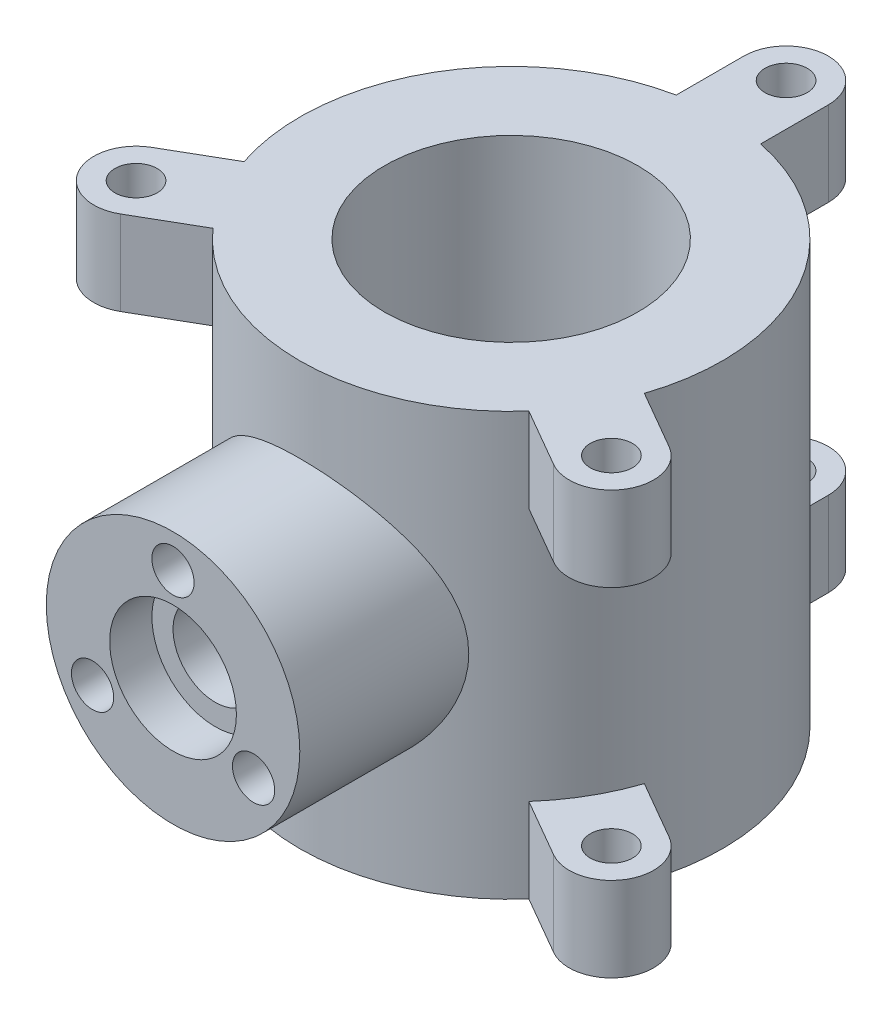
from build123d import *

# Parameters (mm, degrees)
SKETCH1_R           = 30
BOSS_EXTRUDE3_DEPTH = 100
SKETCH1_6_R         = 5
BOSS_EXTRUDE4_DEPTH = 20
BOSS_EXTRUDE6_REACH = 198.02
SKETCH2_R           = 30
SKETCH2_R_2         = 10
SKETCH2_5_R         = 15
SKETCH2_5_R_2       = 10
CUT_EXTRUDE1_DEPTH  = 10
SKETCH2_6_R         = 5
CUT_EXTRUDE2_DEPTH  = 10
CUT_EXTRUDE3_REACH  = 198.02
SKETCH2_7_R         = 10


with BuildPart() as part:
    # Sketch1 → Boss-Extrude3 (new body)
    with BuildSketch(Plane(origin=(0, 0, 0), x_dir=(1, 0, 0), z_dir=(0, 1, 0))):
        with BuildLine():
            ThreePointArc((-37.464834222, -33.11172295), (-0.057995625, -49.999966365), (37.387920062, -33.198545653))
            ThreePointArc((37.387920062, -33.198545653), (43.272243248, -25.050208867), (47.408010349, -15.88963671))
            ThreePointArc((47.408010349, -15.88963671), (49.347748264, -8.049828649), (50, 0))
            ThreePointArc((50, 0), (38.748168948, 31.600307011), (10.056823873, 48.978161394))
            ThreePointArc((10.056823873, 48.978161394), (0.057995625, 49.999966365), (-9.943176127, 49.00135966))
            ThreePointArc((-9.943176127, 49.00135966), (-43.272243248, 25.050208867), (-47.444743935, -15.779615741))
            ThreePointArc((-47.444743935, -15.779615741), (-43.330238873, -24.949757498), (-37.464834222, -33.11172295))
        make_face()
        Circle(SKETCH1_R, mode=Mode.SUBTRACT)
    extrude(amount=BOSS_EXTRUDE3_DEPTH)

    # Sketch1<6> → Boss-Extrude4 (add)
    # profile 1 of 3: a face of its own
    with BuildSketch(Plane(origin=(0, 0, 0), x_dir=(1, 0, 0), z_dir=(0, 1, 0))):
        with BuildLine():
            ThreePointArc((47.408010349, -15.88963671), (43.272243248, -25.050208867), (37.387920062, -33.198545653))
            Line((37.387920062, -33.198545653), (51.264416809, -41.210144786))
            ThreePointArc((51.264416809, -41.210144786), (64.924670847, -37.549890748), (61.264416809, -23.88963671))
            Line((61.264416809, -23.88963671), (47.408010349, -15.88963671))
        make_face()
        with Locations((56.264416809, -32.549890748)):
            Circle(SKETCH1_6_R, mode=Mode.SUBTRACT)
    # profile 2 of 3: a face of its own
    with BuildSketch(Plane(origin=(0, 0, 0), x_dir=(1, 0, 0), z_dir=(0, 1, 0))):
        with BuildLine():
            Line((-51.321240683, -41.11172295), (-37.464834222, -33.11172295))
            ThreePointArc((-37.464834222, -33.11172295), (-43.330238873, -24.949757498), (-47.444743935, -15.779615741))
            Line((-47.444743935, -15.779615741), (-61.321240683, -23.791214874))
            ThreePointArc((-61.321240683, -23.791214874), (-64.981494721, -37.451468912), (-51.321240683, -41.11172295))
        make_face()
        with Locations((-56.321240683, -32.451468912)):
            Circle(SKETCH1_6_R, mode=Mode.SUBTRACT)
    # profile 3 of 3: a face of its own
    with BuildSketch(Plane(origin=(0, 0, 0), x_dir=(1, 0, 0), z_dir=(0, 1, 0))):
        with BuildLine():
            Line((-9.943176127, 65.00135966), (-9.943176127, 49.00135966))
            ThreePointArc((-9.943176127, 49.00135966), (0.057995625, 49.999966365), (10.056823873, 48.978161394))
            Line((10.056823873, 48.978161394), (10.056823873, 65.00135966))
            ThreePointArc((10.056823873, 65.00135966), (0.056823873, 75.00135966), (-9.943176127, 65.00135966))
        make_face()
        with Locations((0.056823873, 65.00135966)):
            Circle(SKETCH1_6_R, mode=Mode.SUBTRACT)
    boss_extrude4 = extrude(amount=BOSS_EXTRUDE4_DEPTH)

    # Mirror3: Boss-Extrude4 across plane
    add(boss_extrude4.mirror(Plane.ZX.offset(50)))

    # Sketch2 → Boss-Extrude6 (add, up to next)
    with BuildSketch(Plane.XY.offset(80), mode=Mode.PRIVATE) as boss_extrude6_sk1:
        with Locations((-0.01922854, 50)):
            Circle(SKETCH2_R)
        with Locations((-0.01922854, 50)):
            Circle(SKETCH2_R_2, mode=Mode.SUBTRACT)
    boss_extrude6_tool1 = extrude(boss_extrude6_sk1.sketch, amount=-BOSS_EXTRUDE6_REACH, mode=Mode.PRIVATE) - part.part
    add(boss_extrude6_tool1.solids().sort_by_distance((-29.1707, 50, 80))[0])

    # Sketch2<5> → Cut-Extrude1 (cut)
    with BuildSketch(Plane.XY.offset(80)):
        with Locations((-0.01922854, 50)):
            Circle(SKETCH2_5_R)
        with Locations((-0.01922854, 50)):
            Circle(SKETCH2_5_R_2, mode=Mode.SUBTRACT)
    extrude(amount=-CUT_EXTRUDE1_DEPTH, mode=Mode.SUBTRACT)

    # Sketch2<6> → Cut-Extrude2 (cut)
    with BuildSketch(Plane.XY.offset(80)):
        with Locations((-0.027689098, 72)):
            Circle(SKETCH2_6_R)
        with Locations((19.037559212, 39.007329498)):
            Circle(SKETCH2_6_R)
        with Locations((-19.067555737, 38.992675383)):
            Circle(SKETCH2_6_R)
    extrude(amount=-CUT_EXTRUDE2_DEPTH, mode=Mode.SUBTRACT)

    # Sketch2<7> → Cut-Extrude3 (cut, up to next)
    with BuildSketch(Plane.XY.offset(80), mode=Mode.PRIVATE) as cut_extrude3_sk1:
        with Locations((-0.01922854, 50)):
            Circle(SKETCH2_7_R)
    cut_extrude3_tool1 = extrude(cut_extrude3_sk1.sketch, amount=-CUT_EXTRUDE3_REACH, mode=Mode.PRIVATE) & part.part
    add(cut_extrude3_tool1.solids().sort_by_distance((-0.019229, 50, 80))[0], mode=Mode.SUBTRACT)


solid = part.part
